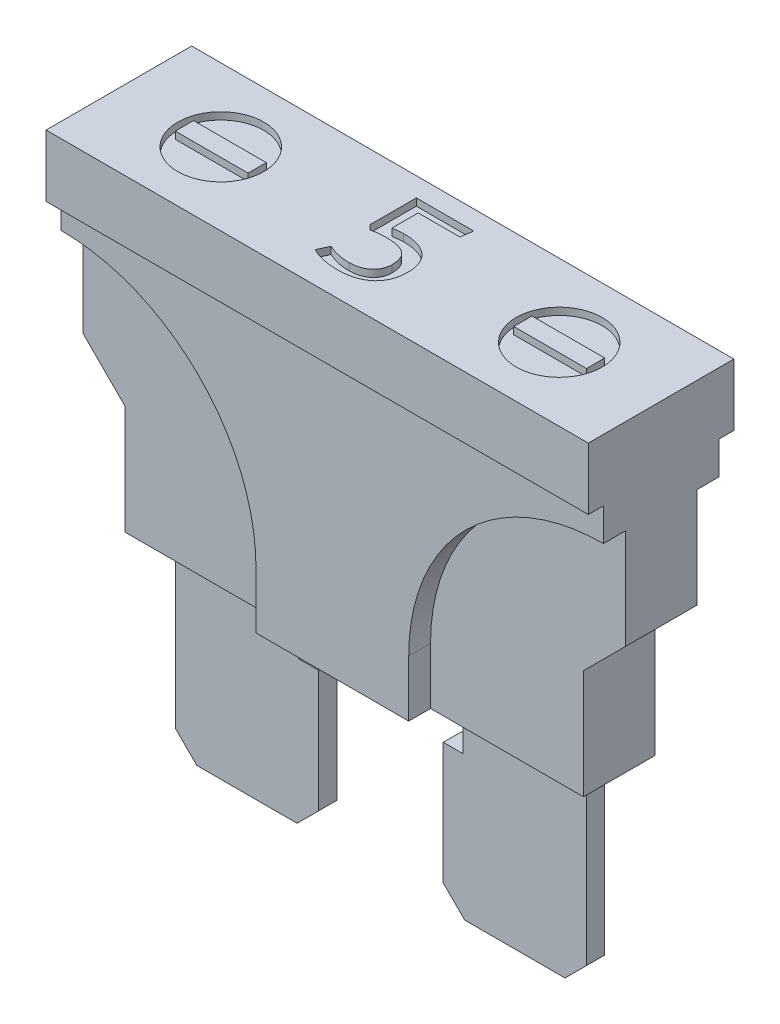
from build123d import *

# Parameters (mm, degrees)
SKETCH3_W             = 1.27
SKETCH3_H             = 2.032
BOSS_EXTRUDE2_DEPTH   = 0.3175
SKETCH4_W             = 5.969
SKETCH4_H             = 2.5
BOSS_EXTRUDE3_DEPTH   = 10.16
BOSS_EXTRUDE3_2_DEPTH = 10.16
BOSS_EXTRUDE4_DEPTH   = 0.762
SKETCH7_W             = 18.923
SKETCH7_H             = 5.08
BOSS_EXTRUDE5_DEPTH   = 2.159
SKETCH9_R             = 1.5
CUT_EXTRUDE1_DEPTH    = 0.25
BOSS_EXTRUDE6_DEPTH   = 1.25
SKETCH11_W            = 5.715
SKETCH11_H            = 0.635
CUT_EXTRUDE2_DEPTH    = 2.659


with BuildPart() as part:
    # Sketch3 → Boss-Extrude2 (new, symmetric)
    with BuildSketch(Plane.XY):
        with BuildLine():
            Line((-7.1755, 5.2705), (-7.1755, -12.7755))
            Line((-7.1755, -12.7755), (-6.4255, -13.5255))
            Line((-6.4255, -13.5255), (-2.9255, -13.5255))
            Line((-2.9255, -13.5255), (-2.1755, -12.7755))
            Line((-2.1755, -12.7755), (-2.1755, -8.5255))
            Line((-2.1755, -8.5255), (-2.8575, -8.5255))
            Line((-2.8575, -8.5255), (-2.8575, -4.6355))
            Line((-2.8575, -4.6355), (-2.2145, -4.6355))
            ThreePointArc((-2.2145, -4.6355), (-1.507393219, -4.342606781), (-1.2145, -3.6355))
            Line((-1.2145, -3.6355), (-1.2145, 0))
            ThreePointArc((-1.2145, 0), (0, 1.2145), (1.2145, 0))
            Line((1.2145, 0), (1.2145, -3.6355))
            ThreePointArc((1.2145, -3.6355), (1.507393219, -4.342606781), (2.2145, -4.6355))
            Line((2.2145, -4.6355), (2.8575, -4.6355))
            Line((2.8575, -4.6355), (2.8575, -8.5255))
            Line((2.8575, -8.5255), (2.1755, -8.5255))
            Line((2.1755, -8.5255), (2.1755, -12.7755))
            Line((2.1755, -12.7755), (2.9255, -13.5255))
            Line((2.9255, -13.5255), (6.4255, -13.5255))
            Line((6.4255, -13.5255), (7.1755, -12.7755))
            Line((7.1755, -12.7755), (7.1755, 5.2705))
            Line((7.1755, 5.2705), (4.6355, 5.2705))
            Line((4.6355, 5.2705), (4.6355, 1.7145))
            Line((4.6355, 1.7145), (2.8575, 1.7145))
            Line((2.8575, 1.7145), (2.8575, -4.1355))
            Line((2.8575, -4.1355), (2.2145, -4.1355))
            ThreePointArc((2.2145, -4.1355), (1.860946609, -3.989053391), (1.7145, -3.6355))
            Line((1.7145, -3.6355), (1.7145, 0))
            ThreePointArc((1.7145, 0), (0, 1.7145), (-1.7145, 0))
            Line((-1.7145, 0), (-1.7145, -3.6355))
            ThreePointArc((-1.7145, -3.6355), (-1.860946609, -3.989053391), (-2.2145, -4.1355))
            Line((-2.2145, -4.1355), (-2.8575, -4.1355))
            Line((-2.8575, -4.1355), (-2.8575, 1.7145))
            Line((-2.8575, 1.7145), (-4.6355, 1.7145))
            Line((-4.6355, 1.7145), (-4.6355, 5.2705))
            Line((-4.6355, 5.2705), (-7.1755, 5.2705))
        make_face()
        with Locations((-5.0165, -3.1195)):
            Rectangle(SKETCH3_W, SKETCH3_H, mode=Mode.SUBTRACT)
        with Locations((5.0165, -3.1195)):
            Rectangle(SKETCH3_W, SKETCH3_H, mode=Mode.SUBTRACT)
    extrude(amount=BOSS_EXTRUDE2_DEPTH, both=True)


with BuildPart() as body_2:
    # Sketch4 → Boss-Extrude3 (new body)
    with BuildSketch(Plane(origin=(0, -6.7945, 0), x_dir=(-1, 0, 0), z_dir=(0, -1, 0))):
        with Locations((5.0165, 0)):
            Rectangle(SKETCH4_W, SKETCH4_H)
    extrude(amount=-BOSS_EXTRUDE3_DEPTH)



with BuildPart() as body_3:
    # Sketch4 → Boss-Extrude3 2 (new body)
    with BuildSketch(Plane(origin=(0, -6.7945, 0), x_dir=(-1, 0, 0), z_dir=(0, -1, 0))):
        with Locations((-5.0165, 0)):
            Rectangle(SKETCH4_W, SKETCH4_H)
    extrude(amount=-BOSS_EXTRUDE3_2_DEPTH)


with BuildPart() as body_2_1:
    add(body_2.part)

    add(body_3.part)  # Boss-Extrude4 merges body 3
    # Sketch6 → Boss-Extrude4 (add)
    with BuildSketch(Plane.XY.offset(1.25)):
        with BuildLine():
            Line((-2.665, -6.7945), (2.665, -6.7945))
            Line((2.665, -6.7945), (2.665, -4.828))
            ThreePointArc((2.665, -4.828), (4.655648762, -0.022148762), (9.4615, 1.9685))
            Line((9.4615, 1.9685), (9.4615, 5.2705))
            Line((9.4615, 5.2705), (-9.4615, 5.2705))
            Line((-9.4615, 5.2705), (-9.4615, 1.9685))
            ThreePointArc((-9.4615, 1.9685), (-4.655648762, -0.022148762), (-2.665, -4.828))
            Line((-2.665, -4.828), (-2.665, -6.7945))
        make_face()
    boss_extrude4 = extrude(amount=BOSS_EXTRUDE4_DEPTH)

    # Mirror1: Boss-Extrude4 across plane
    add(boss_extrude4.mirror(Plane.XY))

    # Sketch7 → Boss-Extrude5 (add)
    with BuildSketch(Plane(origin=(0, 5.2705, 0), x_dir=(1, 0, 0), z_dir=(0, 1, 0))):
        Rectangle(SKETCH7_W, SKETCH7_H)
    extrude(amount=-BOSS_EXTRUDE5_DEPTH)

    # Sketch9 → Cut-Extrude1 (cut)
    with BuildSketch(Plane(origin=(0, 5.2705, 0), x_dir=(1, 0, 0), z_dir=(0, 1, 0))):
        with Locations(Location((5.9055, 0, 0), (0, 0, 180))):
            Circle(SKETCH9_R)
        with Locations(Location((-5.9055, 0, 0), (0, 0, 180))):
            Circle(SKETCH9_R)
        with BuildLine():
            add(Edge.make_bspline(
                [(-0.08984375, 0.569), (-0.041112326, 0.568108111), (0.053414477, 0.566378069), (0.190723499, 0.552814929), (0.319377928, 0.531456245), (0.439472081, 0.500279339), (0.550699522, 0.459762304), (0.653038741, 0.410273503), (0.746924888, 0.352369167), (0.831303213, 0.284895181), (0.906920064, 0.2097577), (0.972030118, 0.126419749), (1.027080852, 0.035589247), (1.072732156, -0.062206793), (1.106895811, -0.16811613), (1.131527898, -0.280883518), (1.147954726, -0.401094174), (1.149305744, -0.483807908), (1.15, -0.5263125)],
                knots=[0, 0, 0, 0, 1.242083543, 2.409332159, 3.513840015, 4.563706157, 5.567627895, 6.526667597, 7.456968273, 8.373499391, 9.274804841, 10.168572785, 11.062340729, 11.977163179, 12.91348467, 13.892783447, 14.917152251, 16, 16, 16, 16], degree=3))
            add(Edge.make_bspline(
                [(1.15, -0.5263125), (1.148152893, -0.582923429), (1.144556453, -0.693148717), (1.117996809, -0.852947479), (1.072567825, -1.001160546), (1.019404848, -1.115248113), (0.968052148, -1.199737013), (0.924198198, -1.258684227), (0.876281091, -1.314942165), (0.823130962, -1.366793678), (0.7658788, -1.415961746), (0.702915837, -1.460138408), (0.635829398, -1.501785367), (0.563665011, -1.539157356), (0.487103454, -1.573020782), (0.405646825, -1.601381334), (0.3203851, -1.627046594), (0.230092594, -1.645967217), (0.135473508, -1.661563595), (0.036208375, -1.67363778), (-0.067638046, -1.679421606), (-0.138275893, -1.680467709), (-0.17421875, -1.681)],
                knots=[0, 0, 0, 0, 1.699567221, 3.309171754, 4.847737104, 6.341571698, 7.075209316, 7.81345883, 8.545469153, 9.291997436, 10.040979259, 10.809148184, 11.599139078, 12.410628951, 13.247532119, 14.110765742, 14.999137177, 15.919460584, 16.878538601, 17.878602103, 18.920563088, 20, 20, 20, 20], degree=3))
            add(Edge.make_bspline(
                [(-0.17421875, -1.681), (-0.219558645, -1.68057344), (-0.308815127, -1.67973371), (-0.440704841, -1.667883367), (-0.568843838, -1.651222543), (-0.693064547, -1.62703803), (-0.813336116, -1.595631054), (-0.929328981, -1.557284417), (-1.042251827, -1.51310255), (-1.11405573, -1.47713165), (-1.15, -1.459125)],
                knots=[0, 0, 0, 0, 1.07657564, 2.119355445, 3.142877715, 4.14490383, 5.123106261, 6.09331634, 7.045534418, 8, 8, 8, 8], degree=3))
            Line((-1.15, -1.459125), (-0.975, -1.081))
            add(Edge.make_bspline(
                [(-0.975, -1.081), (-0.91174514, -1.108522329), (-0.786072006, -1.163202988), (-0.587924377, -1.218900249), (-0.384593202, -1.253941113), (-0.246758984, -1.257908313), (-0.17734375, -1.25990625)],
                knots=[0, 0, 0, 0, 1.003632589, 1.993991511, 2.989746143, 4, 4, 4, 4], degree=3))
            add(Edge.make_bspline(
                [(-0.17734375, -1.25990625), (-0.135864948, -1.259024709), (-0.055648257, -1.25731988), (0.060047463, -1.239445634), (0.167164964, -1.21215425), (0.264332538, -1.171585644), (0.352324323, -1.123102192), (0.428159993, -1.064444524), (0.49480543, -1.000288864), (0.547575983, -0.926657097), (0.590566098, -0.84764168), (0.619803667, -0.762543287), (0.638697544, -0.672973017), (0.641008001, -0.61156687), (0.6421875, -0.58021875)],
                knots=[0, 0, 0, 0, 1.248636637, 2.414763568, 3.51849477, 4.570401148, 5.578565807, 6.535744226, 7.451111541, 8.35497541, 9.25351194, 10.15174016, 11.056454852, 12, 12, 12, 12], degree=3))
            add(Edge.make_bspline(
                [(0.6421875, -0.58021875), (0.641434932, -0.542404319), (0.639990797, -0.469840673), (0.624965164, -0.36577922), (0.60038123, -0.271400564), (0.565143495, -0.186237388), (0.51735571, -0.109484037), (0.453835804, -0.042812869), (0.375615671, 0.014693197), (0.282902013, 0.063642259), (0.173078392, 0.101624572), (0.045715757, 0.129348413), (-0.100385952, 0.145157315), (-0.203866603, 0.14695534), (-0.25859375, 0.14790625)],
                knots=[0, 0, 0, 0, 1.017137661, 1.951826756, 2.822266574, 3.63582456, 4.423334301, 5.241438264, 6.097911455, 7.025955007, 8.052323392, 9.215437194, 10.527346152, 12, 12, 12, 12], degree=3))
            add(Edge.make_bspline(
                [(-0.25859375, 0.14790625), (-0.310702302, 0.147191661), (-0.409056504, 0.145842883), (-0.548138527, 0.135026811), (-0.670420562, 0.117577348), (-0.744930117, 0.097770699), (-0.7796875, 0.08853125)],
                knots=[0, 0, 0, 0, 1.188276599, 2.242856334, 3.180323729, 4, 4, 4, 4], degree=3))
            Line((-0.7796875, 0.08853125), (-0.95, 0.25884375))
            Line((-0.95, 0.25884375), (-0.95, 1.869))
            Line((-0.95, 1.869), (1.05, 1.869))
            Line((1.05, 1.869), (0.99375, 1.44790625))
            Line((0.99375, 1.44790625), (-0.4640625, 1.44790625))
            Line((-0.4640625, 1.44790625), (-0.4640625, 0.52603125))
            add(Edge.make_bspline(
                [(-0.4640625, 0.52603125), (-0.400980755, 0.538463192), (-0.277382081, 0.56282161), (-0.151485695, 0.566969226), (-0.08984375, 0.569)],
                knots=[0, 0, 0, 0, 1.020751159, 2, 2, 2, 2], degree=3))
        make_face()
    extrude(amount=-CUT_EXTRUDE1_DEPTH, mode=Mode.SUBTRACT)

    # Sketch10 → Boss-Extrude6 (add, symmetric)
    with BuildSketch(Plane.XY):
        Polygon((-9.4615, 3.1115), (-9.4615, -1.524), (-8.001, -2.9845), (-8.001, 3.1115), align=None)
        Polygon((8.001, 3.1115), (8.001, -2.9845), (9.4615, -1.524), (9.4615, 3.1115), align=None)
    extrude(amount=BOSS_EXTRUDE6_DEPTH, both=True)

    # Sketch11 → Cut-Extrude2 (cut)
    with BuildSketch(Plane.XZ.offset(6.7945)):
        Rectangle(SKETCH11_W, SKETCH11_H)
    extrude(amount=-CUT_EXTRUDE2_DEPTH, mode=Mode.SUBTRACT)


solid = Compound([part.part, body_2_1.part])
